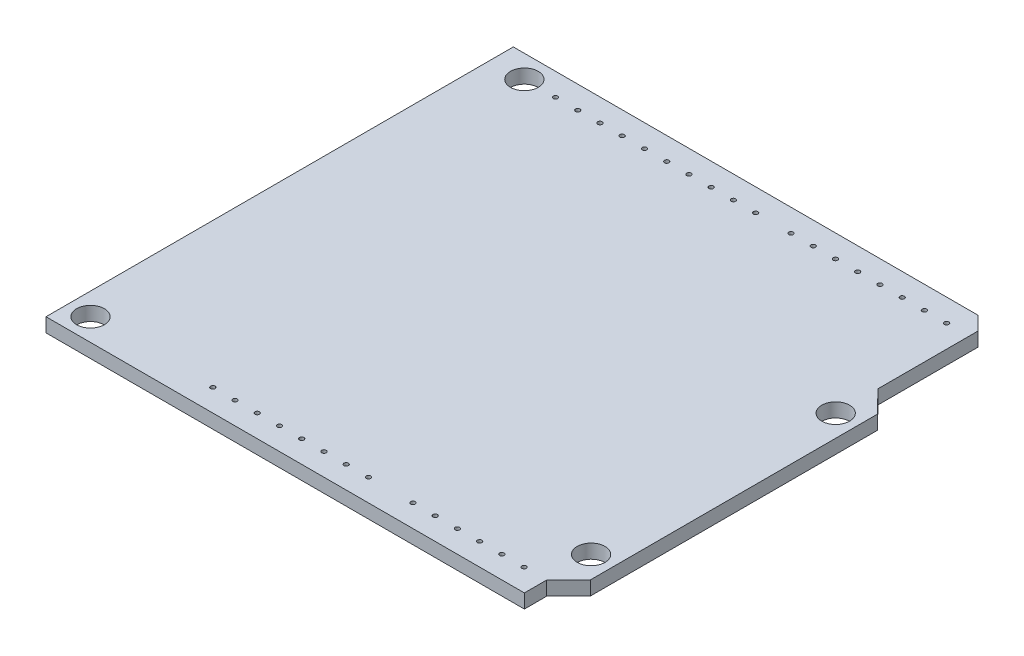
from build123d import *

# Parameters (mm, degrees)
SALIENTE_EXTRUIR1_DEPTH = 1.6002
PINOUT_R                = 0.254
CORTAR_EXTRUIR2_DEPTH   = 1.6002
DRILLS_R                = 1.5875
CORTAR_EXTRUIR3_DEPTH   = 1.6002


with BuildPart() as part:
    # Board → Saliente-Extruir1 (new body)
    with BuildSketch(Plane(origin=(0, 0, 0), x_dir=(1, 0, 0), z_dir=(0, 1, 0))):
        Polygon((57.12, 37.846), (57.12, 5.08), (54.64, 2.54), (54.64, 0), (0, 0), (0, 53.378473106), (53.075207648, 53.378473106), (54.64, 51.813680753), (54.64, 40.386), align=None)
    extrude(amount=SALIENTE_EXTRUIR1_DEPTH)

    # Pinout → Cortar-Extruir2 (cut)
    with BuildSketch(Plane(origin=(0, 0, 0), x_dir=(1, 0, 0), z_dir=(0, 1, 0))):
        with Locations(Location((52.07000008, 2.54, 0), (0, 0, 270))):
            Circle(PINOUT_R)
        with Locations(Location((49.53000008, 2.54, 0), (0, 0, 270))):
            Circle(PINOUT_R)
        with Locations(Location((46.99000008, 2.54, 0), (0, 0, 270))):
            Circle(PINOUT_R)
        with Locations(Location((44.45000008, 2.54, 0), (0, 0, 270))):
            Circle(PINOUT_R)
        with Locations(Location((41.91000008, 2.54, 0), (0, 0, 270))):
            Circle(PINOUT_R)
        with Locations(Location((39.37000008, 2.54, 0), (0, 0, 270))):
            Circle(PINOUT_R)
        with Locations(Location((34.29000008, 2.54, 0), (0, 0, 270))):
            Circle(PINOUT_R)
        with Locations(Location((31.75000008, 2.54, 0), (0, 0, 270))):
            Circle(PINOUT_R)
        with Locations(Location((29.21000008, 2.54, 0), (0, 0, 270))):
            Circle(PINOUT_R)
        with Locations(Location((26.67000008, 2.54, 0), (0, 0, 270))):
            Circle(PINOUT_R)
        with Locations(Location((24.13000008, 2.54, 0), (0, 0, 270))):
            Circle(PINOUT_R)
        with Locations(Location((21.59000008, 2.54, 0), (0, 0, 270))):
            Circle(PINOUT_R)
        with Locations(Location((19.05000008, 2.54, 0), (0, 0, 270))):
            Circle(PINOUT_R)
        with Locations(Location((16.51000008, 2.54, 0), (0, 0, 270))):
            Circle(PINOUT_R)
        with Locations(Location((52.07000008, 50.8, 0), (0, 0, 270))):
            Circle(PINOUT_R)
        with Locations(Location((49.53000008, 50.8, 0), (0, 0, 270))):
            Circle(PINOUT_R)
        with Locations(Location((46.99000008, 50.8, 0), (0, 0, 270))):
            Circle(PINOUT_R)
        with Locations(Location((44.45000008, 50.8, 0), (0, 0, 270))):
            Circle(PINOUT_R)
        with Locations(Location((41.91000008, 50.8, 0), (0, 0, 270))):
            Circle(PINOUT_R)
        with Locations(Location((39.37000008, 50.8, 0), (0, 0, 270))):
            Circle(PINOUT_R)
        with Locations(Location((36.83000008, 50.8, 0), (0, 0, 270))):
            Circle(PINOUT_R)
        with Locations(Location((34.29000008, 50.8, 0), (0, 0, 270))):
            Circle(PINOUT_R)
        with Locations(Location((30.25600002, 50.8, 0), (0, 0, 270))):
            Circle(PINOUT_R)
        with Locations(Location((27.71600002, 50.8, 0), (0, 0, 270))):
            Circle(PINOUT_R)
        with Locations(Location((25.17600002, 50.8, 0), (0, 0, 270))):
            Circle(PINOUT_R)
        with Locations(Location((22.63600002, 50.8, 0), (0, 0, 270))):
            Circle(PINOUT_R)
        with Locations(Location((20.09600002, 50.8, 0), (0, 0, 270))):
            Circle(PINOUT_R)
        with Locations(Location((17.55600002, 50.8, 0), (0, 0, 270))):
            Circle(PINOUT_R)
        with Locations(Location((15.01600002, 50.8, 0), (0, 0, 270))):
            Circle(PINOUT_R)
        with Locations(Location((12.47600002, 50.8, 0), (0, 0, 270))):
            Circle(PINOUT_R)
        with Locations(Location((9.93600002, 50.8, 0), (0, 0, 270))):
            Circle(PINOUT_R)
        with Locations(Location((7.39600002, 50.8, 0), (0, 0, 270))):
            Circle(PINOUT_R)
    extrude(amount=CORTAR_EXTRUIR2_DEPTH, mode=Mode.SUBTRACT)

    # Drills → Cortar-Extruir3 (cut)
    with BuildSketch(Plane(origin=(0, 0, 0), x_dir=(1, 0, 0), z_dir=(0, 1, 0))):
        with Locations(Location((3.84, 50.8, 0), (0, 0, 270))):
            Circle(DRILLS_R)
        with Locations(Location((54.64, 35.56, 0), (0, 0, 270))):
            Circle(DRILLS_R)
        with Locations(Location((54.64, 7.62, 0), (0, 0, 270))):
            Circle(DRILLS_R)
        with Locations(Location((2.540000009, 2.54, 0), (0, 0, 270))):
            Circle(DRILLS_R)
    extrude(amount=CORTAR_EXTRUIR3_DEPTH, mode=Mode.SUBTRACT)


solid = part.part
